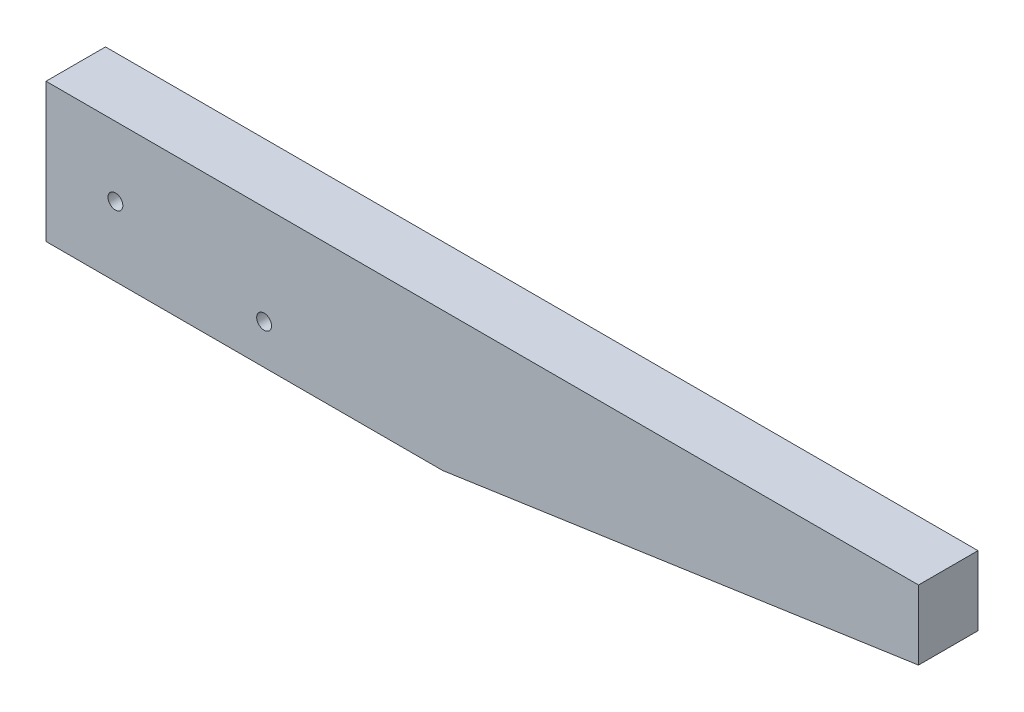
from build123d import *

# Parameters (mm, degrees)
SKETCH1_W                        = 558.8
SKETCH1_H                        = 88.9
BOSS_EXTRUDE1_DEPTH              = 38.1
CUT_EXTRUDE1_DEPTH               = 568.108684469
F_3_8_0_375_DIAMETER_HOLE1_D     = 9.525
F_3_8_0_375_DIAMETER_HOLE1_DEPTH = 76.2
F_3_8_0_375_DIAMETER_HOLE1_TIP   = 2.861598698
SKETCH8_R                        = 4.7625
CUT_EXTRUDE2_DEPTH               = 568.108684469


with BuildPart() as part:
    # Sketch1 → Boss-Extrude1 (new body)
    with BuildSketch(Plane.XY):
        with Locations((279.4, 44.45)):
            Rectangle(SKETCH1_W, SKETCH1_H)
    extrude(amount=BOSS_EXTRUDE1_DEPTH)

    # Sketch2 → Cut-Extrude1 (cut, through all)
    with BuildSketch(Plane.XY.offset(38.1)):
        Polygon((558.8, 44.45), (254, 0), (558.8, 0), align=None)
    extrude(amount=-CUT_EXTRUDE1_DEPTH, mode=Mode.SUBTRACT)

    # 3/8 (0.375) Diameter Hole1
    with Locations(Plane.XY.offset(38.1)):
        with Locations((44.45, 44.45)):
            Hole(F_3_8_0_375_DIAMETER_HOLE1_D / 2, depth=F_3_8_0_375_DIAMETER_HOLE1_DEPTH)
            with Locations((0, 0, -(F_3_8_0_375_DIAMETER_HOLE1_DEPTH + F_3_8_0_375_DIAMETER_HOLE1_TIP / 2))):  # 118° drill point
                Cone(0, F_3_8_0_375_DIAMETER_HOLE1_D / 2, F_3_8_0_375_DIAMETER_HOLE1_TIP, mode=Mode.SUBTRACT)

    # Sketch8 → Cut-Extrude2 (cut, through all)
    with BuildSketch(Plane.XY.offset(38.1)):
        with Locations((139.7, 25.4)):
            Circle(SKETCH8_R)
    extrude(amount=-CUT_EXTRUDE2_DEPTH, mode=Mode.SUBTRACT)


solid = part.part
